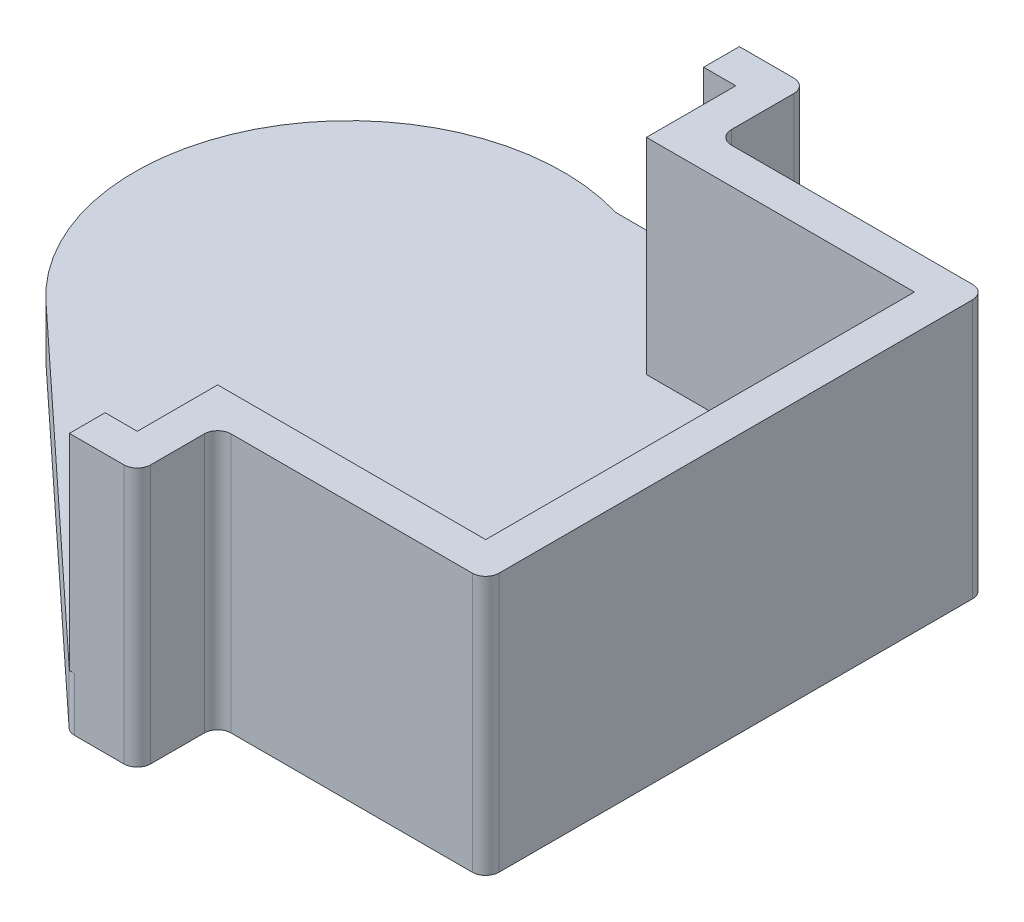
from build123d import *

# Parameters (mm, degrees)
BRACKET_DEPTH       = 11.5
BOSS_EXTRUDE1_START = -3
BOSS_EXTRUDE1_DEPTH = 3
BOSS_EXTRUDE2_START = -3
SKETCH15_R          = 2
BOSS_EXTRUDE2_DEPTH = 3.5


with BuildPart() as part:
    # Sketch9 → Bracket (new body)
    with BuildSketch(Plane(origin=(0, 0, 0), x_dir=(1, 0, 0), z_dir=(0, 1, 0))):
        with BuildLine():
            Line((5.15, -5), (4.65, -5))
            Line((4.65, -5), (3.35, -5))
            Line((3.35, -5), (3.35, -7))
            Line((3.35, -7), (6.4, -7))
            ThreePointArc((6.4, -7), (6.930330086, -6.780330086), (7.15, -6.25))
            Line((7.15, -6.25), (7.15, -5))
            Line((7.15, -5), (7.15, -3.25))
            ThreePointArc((7.15, -3.25), (7.369669914, -2.719669914), (7.9, -2.5))
            Line((7.9, -2.5), (21.4, -2.5))
            ThreePointArc((21.4, -2.5), (21.930330086, -2.280330086), (22.15, -1.75))
            Line((22.15, -1.75), (22.15, 24.75))
            ThreePointArc((22.15, 24.75), (21.930330086, 25.280330086), (21.4, 25.5))
            Line((21.4, 25.5), (7.9, 25.5))
            ThreePointArc((7.9, 25.5), (7.369669914, 25.719669914), (7.15, 26.25))
            Line((7.15, 26.25), (7.15, 28))
            Line((7.15, 28), (7.15, 29.75))
            ThreePointArc((7.15, 29.75), (6.930330086, 30.280330086), (6.4, 30.5))
            Line((6.4, 30.5), (5.15, 30.5))
            Line((5.15, 30.5), (3.35, 30.5))
            Line((3.35, 30.5), (3.35, 28.5))
            Line((3.35, 28.5), (5.15, 28.5))
            Line((5.15, 28.5), (5.15, 28))
            Line((5.15, 28), (5.15, 23.5))
            Line((5.15, 23.5), (20.15, 23.5))
            Line((20.15, 23.5), (20.15, -0.5))
            Line((20.15, -0.5), (5.15, -0.5))
            Line((5.15, -0.5), (5.15, -5))
        make_face()
    extrude(amount=BRACKET_DEPTH)

    # Sketch12 → Boss-Extrude1 (add)
    with BuildSketch(Plane(origin=(0, 0, 0), x_dir=(1, 0, 0), z_dir=(0, 1, 0)).offset(BOSS_EXTRUDE1_START)):
        with BuildLine():
            Line((3.134136634, -6.799408153), (-15.169112008, 10.208954707))
            ThreePointArc((-15.169112008, 10.208954707), (-17.445237733, 24.907700028), (-3.6745965, 30.529381479))
            ThreePointArc((-3.6745965, 30.529381479), (-3.571695801, 30.507381696), (-3.466728879, 30.5))
            Line((-3.466728879, 30.5), (6.4, 30.5))
            ThreePointArc((6.4, 30.5), (6.930330086, 30.280330086), (7.15, 29.75))
            Line((7.15, 29.75), (7.15, 26.25))
            ThreePointArc((7.15, 26.25), (7.369669914, 25.719669914), (7.9, 25.5))
            Line((7.9, 25.5), (21.4, 25.5))
            ThreePointArc((21.4, 25.5), (21.930330086, 25.280330086), (22.15, 24.75))
            Line((22.15, 24.75), (22.15, -1.75))
            ThreePointArc((22.15, -1.75), (21.930330086, -2.280330086), (21.4, -2.5))
            Line((21.4, -2.5), (7.9, -2.5))
            ThreePointArc((7.9, -2.5), (7.369669914, -2.719669914), (7.15, -3.25))
            Line((7.15, -3.25), (7.15, -6.25))
            ThreePointArc((7.15, -6.25), (6.930330086, -6.780330086), (6.4, -7))
            Line((6.4, -7), (3.644676233, -7))
            ThreePointArc((3.644676233, -7), (3.370410043, -6.948053048), (3.134136634, -6.799408153))
        make_face()
    extrude(amount=BOSS_EXTRUDE1_DEPTH)

    # Sketch15 → Boss-Extrude2 (add)
    with BuildSketch(Plane(origin=(0, 0, 0), x_dir=(1, 0, 0), z_dir=(0, 1, 0)).offset(BOSS_EXTRUDE2_START)):
        with Locations(Location((-7, 26.071067812, 0), (0, 0, 270))):
            Circle(SKETCH15_R)
        with Locations(Location((0.071067812, 19, 0), (0, 0, 270))):
            Circle(SKETCH15_R)
        with Locations(Location((-7, 11.928932188, 0), (0, 0, 270))):
            Circle(SKETCH15_R)
        with Locations(Location((-14.071067812, 19, 0), (0, 0, 270))):
            Circle(SKETCH15_R)
    extrude(amount=-BOSS_EXTRUDE2_DEPTH)


solid = part.part
